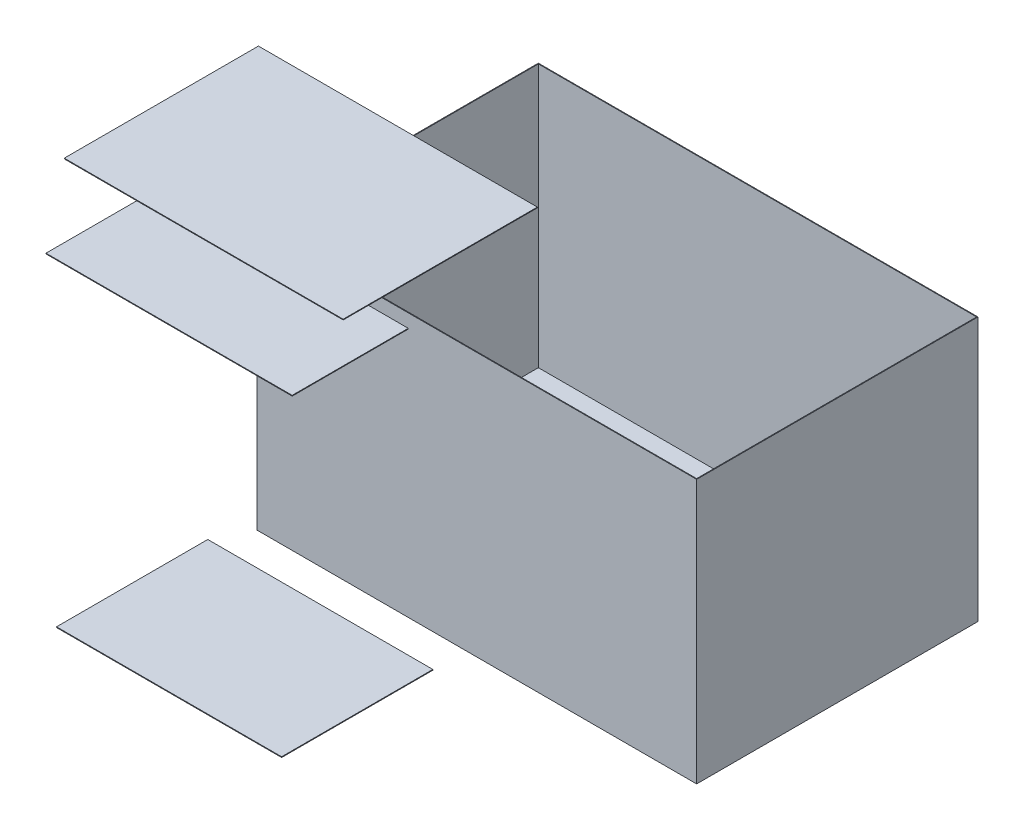
from build123d import *

# Parameters (mm, degrees)
MASTER_FOOTPRINT_W            = 1250
MASTER_FOOTPRINT_H            = 800
BATH_BASE_PLATE_DEPTH         = 750
BATH_SHELL_2MM_T              = -2
INLET_IMPACT_BAFFLE_START     = 125
SKETCH_1_W                    = 640
SKETCH_1_H                    = 430
INLET_IMPACT_BAFFLE_DEPTH     = 2
OUTLET_SUBMERGED_BAFFLE_START = 1030
SKETCH_3_W                    = 700
SKETCH_3_H                    = 330
OUTLET_SUBMERGED_BAFFLE_DEPTH = 2
OVERFLOW_WEIR_Z550_START      = 1190
SKETCH_4_W                    = 793
SKETCH_4_H                    = 552
OVERFLOW_WEIR_Z550_DEPTH      = 2


with BuildPart() as part:
    # MASTER_FOOTPRINT → BATH_BASE_PLATE (new body)
    with BuildSketch(Plane(origin=(0, 0, 0), x_dir=(1, 0, 0), z_dir=(0, 1, 0))):
        with Locations((625, 400)):
            Rectangle(MASTER_FOOTPRINT_W, MASTER_FOOTPRINT_H)
    extrude(amount=BATH_BASE_PLATE_DEPTH)

    # BATH_SHELL_2MM
    bath_shell_2mm_openings = [part.faces().sort_by_distance(p)[0] for p in [
        (625, 750, -400),
    ]]
    offset(amount=BATH_SHELL_2MM_T, openings=bath_shell_2mm_openings, kind=Kind.INTERSECTION)


with BuildPart() as body_2:
    # Эскиз1 → INLET_IMPACT_BAFFLE (new body)
    with BuildSketch(Plane(origin=(0, 0, 0), x_dir=(1, 0, 0), z_dir=(0, 1, 0)).offset(INLET_IMPACT_BAFFLE_START)):
        with Locations((400, -435)):
            Rectangle(SKETCH_1_W, SKETCH_1_H)
    extrude(amount=INLET_IMPACT_BAFFLE_DEPTH)


with BuildPart() as body_3:
    # Эскиз3 → OUTLET_SUBMERGED_BAFFLE (new body)
    with BuildSketch(Plane(origin=(0, 0, 0), x_dir=(1, 0, 0), z_dir=(0, 1, 0)).offset(OUTLET_SUBMERGED_BAFFLE_START)):
        with Locations((400, -485)):
            Rectangle(SKETCH_3_W, SKETCH_3_H)
    extrude(amount=OUTLET_SUBMERGED_BAFFLE_DEPTH)


with BuildPart() as body_4:
    # Эскиз4 → OVERFLOW_WEIR_Z550 (new body)
    with BuildSketch(Plane(origin=(0, 0, 0), x_dir=(1, 0, 0), z_dir=(0, 1, 0)).offset(OVERFLOW_WEIR_Z550_START)):
        with Locations((398.5, -274)):
            Rectangle(SKETCH_4_W, SKETCH_4_H)
    extrude(amount=OVERFLOW_WEIR_Z550_DEPTH)


solid = Compound([part.part, body_2.part, body_3.part, body_4.part])
